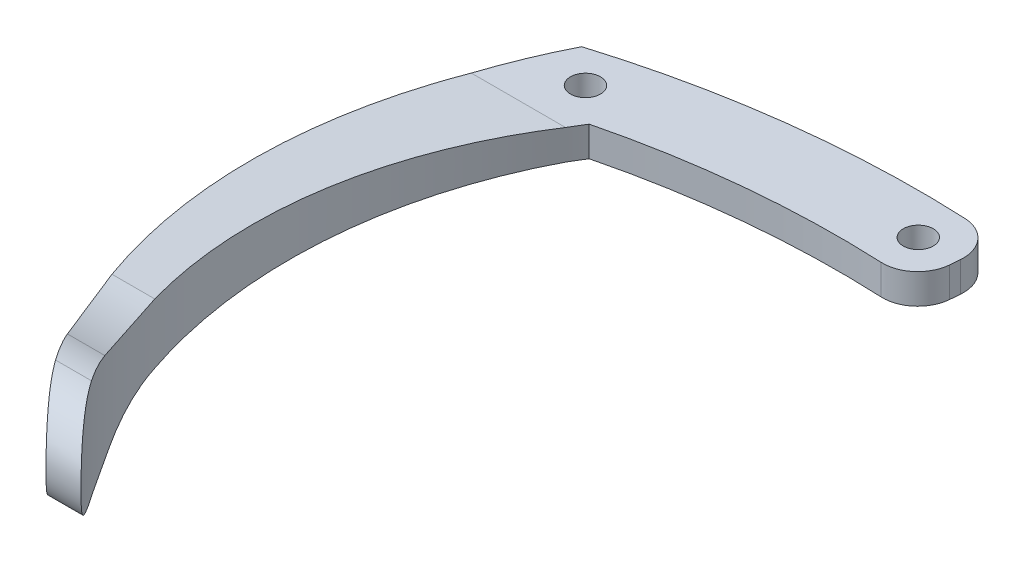
from build123d import *

# Parameters (mm, degrees)
SKETCH1_R               = 1.5
BOSS_EXTRUDE1_DEPTH     = 10
CUT_EXTRUDE2_DEPTH      = 74.03125097
CUT_EXTRUDE2_DEPTH_BACK = 74.03125097


with BuildPart() as part:
    # Sketch1 → Boss-Extrude1 (new body)
    with BuildSketch(Plane(origin=(0, 0, 0), x_dir=(1, 0, 0), z_dir=(0, 1, 0))):
        with BuildLine():
            Line((8.374136589, -61.936449982), (11.874136589, -61.936449982))
            ThreePointArc((11.874136589, -61.936449982), (0.081914259, -34.944518005), (7.081336693, -6.332824854))
            ThreePointArc((7.081336693, -6.332824854), (20.262375594, -4.05005898), (33.635120834, -3.702940444))
            ThreePointArc((33.635120834, -3.702940444), (36.107429575, -2.837508611), (37.28672817, -0.498590572))
            Line((37.28672817, -0.498590572), (37.370159468, 0.498590572))
            ThreePointArc((37.370159468, 0.498590572), (36.513517912, 3.098421057), (34.047468247, 4.286508746))
            ThreePointArc((34.047468247, 4.286508746), (16.83848946, 3.614641035), (0, 0))
            ThreePointArc((0, 0), (-5.465437597, -32.273294991), (8.374136589, -61.936449982))
        make_face()
        with Locations(Location((3.540668347, -3.166412427, 0), (0, 0, 270))):
            Circle(SKETCH1_R, mode=Mode.SUBTRACT)
        with Locations(Location((33.338080448, 0.314138113, 0), (0, 0, 270))):
            Circle(SKETCH1_R, mode=Mode.SUBTRACT)
    extrude(amount=BOSS_EXTRUDE1_DEPTH)

    # Sketch3 → Cut-Extrude2 (cut, two sides: drawn at the far end of the back side and taken through both)
    with BuildSketch(Plane(origin=(0, 0, 0), x_dir=(0, 0, -1), z_dir=(1, 0, 0)).offset(-CUT_EXTRUDE2_DEPTH_BACK)):
        with BuildLine():
            Line((12.083964948, 3.5), (12.083964948, -15.222203612))
            Line((12.083964948, -15.222203612), (-68.488730391, -15.222203612))
            Line((-68.488730391, -15.222203612), (-68.488730391, 24.123888187))
            Line((-68.488730391, 24.123888187), (12.083964948, 24.123888187))
            Line((12.083964948, 24.123888187), (12.083964948, 6.5))
            Line((12.083964948, 6.5), (-7.802141901, 6.5))
            Line((-7.802141901, 6.5), (-44.686449982, 8))
            ThreePointArc((-44.686449982, 8), (-49.121881317, 8.286668563), (-53.436449982, 9.35424864))
            add(Edge.make_bspline(
                [(-53.436449982, 9.35424864), (-55.093764724, 9.924838877), (-56.936449982, 10)],
                knots=[1.159942568, 1.159942568, 1.159942568, 1.612339429, 1.612339429, 1.612339429], degree=2, weights=[1, 0.97452603, 1]))
            add(Edge.make_bspline(
                [(-56.936449982, 10), (-61.936449982, 10), (-61.936449982, 5), (-61.936449982, 0), (-56.936449982, 0)],
                knots=[3.141592654, 3.141592654, 3.141592654, 4.71238898, 4.71238898, 6.283185307, 6.283185307, 6.283185307], degree=2, weights=[1, 0.707106781, 1, 0.707106781, 1]))
            add(Edge.make_bspline(
                [(-56.936449982, 0), (-54.632768005, -0.093964676), (-52.681317703, 0.590934971)],
                knots=[4.753932083, 4.753932083, 4.753932083, 5.314222961, 5.314222961, 5.314222961], degree=2, weights=[1, 0.961015235, 1]))
            ThreePointArc((-52.681317703, 0.590934971), (-48.741460404, 1.622150064), (-44.686449982, 2))
            Line((-44.686449982, 2), (-7.802141901, 3.5))
            Line((-7.802141901, 3.5), (12.083964948, 3.5))
        make_face()
    extrude(amount=CUT_EXTRUDE2_DEPTH + CUT_EXTRUDE2_DEPTH_BACK, mode=Mode.SUBTRACT)


solid = part.part
